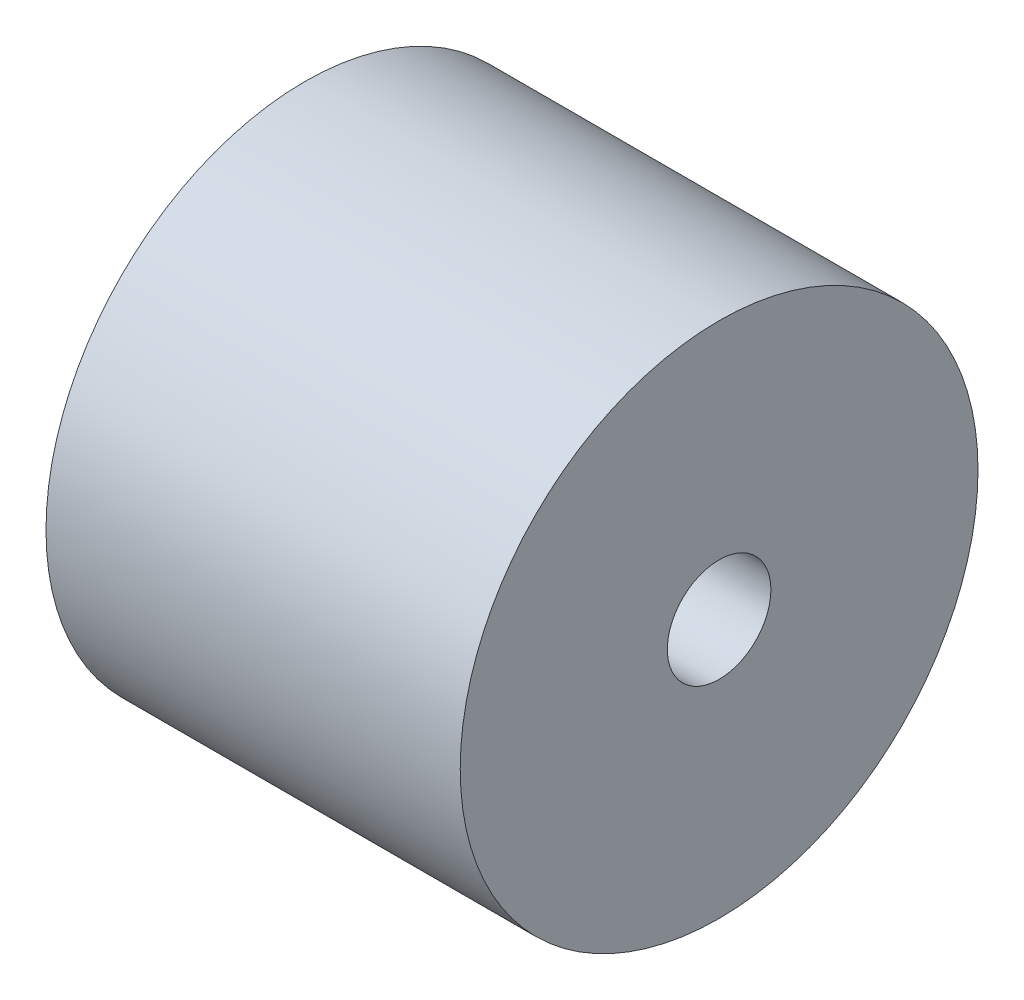
from build123d import *

# Parameters (mm, degrees)
SKETCH_1_R          = 10
EXTRUDE_1_DEPTH     = 16
SKETCH_2_R          = 2
CUT_EXTRUDE_1_DEPTH = 10
SKETCH_4_R          = 8.4
CUT_EXTRUDE_2_DEPTH = 1
SKETCH_5_R          = 3.93
EXTRUDE_2_DEPTH     = 1


with BuildPart() as part:
    # 草图1 → 凸台-拉伸1 (new body)
    with BuildSketch(Plane(origin=(0, 0, 0), x_dir=(0, 0, -1), z_dir=(1, 0, 0))):
        Circle(SKETCH_1_R)
    extrude(amount=EXTRUDE_1_DEPTH)

    # 草图2 → 切除-拉伸1 (cut)
    with BuildSketch(Plane(origin=(16, 0, 0), x_dir=(0, 0, -1), z_dir=(1, 0, 0))):
        Circle(SKETCH_2_R)
    extrude(amount=-CUT_EXTRUDE_1_DEPTH, mode=Mode.SUBTRACT)

    # 草图4 → 切除-拉伸2 (cut)
    with BuildSketch(Plane.ZY):
        Circle(SKETCH_4_R)
    extrude(amount=-CUT_EXTRUDE_2_DEPTH, mode=Mode.SUBTRACT)

    # 草图5 → 凸台-拉伸2 (add)
    with BuildSketch(Plane.ZY.offset(-1)):
        Circle(SKETCH_5_R)
    extrude(amount=EXTRUDE_2_DEPTH)


solid = part.part
